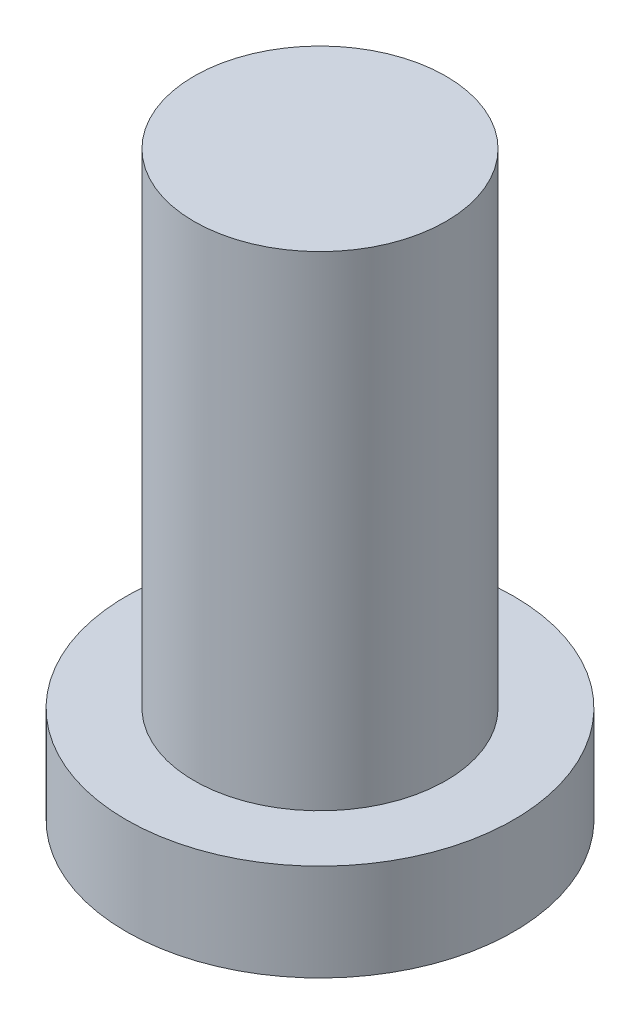
from build123d import *

# Parameters (mm, degrees)
SKETCH1_R           = 1.3
BOSS_EXTRUDE1_DEPTH = 5
SKETCH2_R           = 2
BOSS_EXTRUDE2_DEPTH = 1


with BuildPart() as part:
    # Sketch1 → Boss-Extrude1 (new body)
    with BuildSketch(Plane(origin=(0, 0, 0), x_dir=(1, 0, 0), z_dir=(0, 1, 0))):
        with Locations(Location((0, 0, 0), (0, 0, 270))):
            Circle(SKETCH1_R)
    extrude(amount=BOSS_EXTRUDE1_DEPTH)

    # Sketch2 → Boss-Extrude2 (add)
    with BuildSketch(Plane.XZ):
        with Locations(Location((0, 0, 0), (0, 0, 270))):
            Circle(SKETCH2_R)
    extrude(amount=BOSS_EXTRUDE2_DEPTH)


solid = part.part
